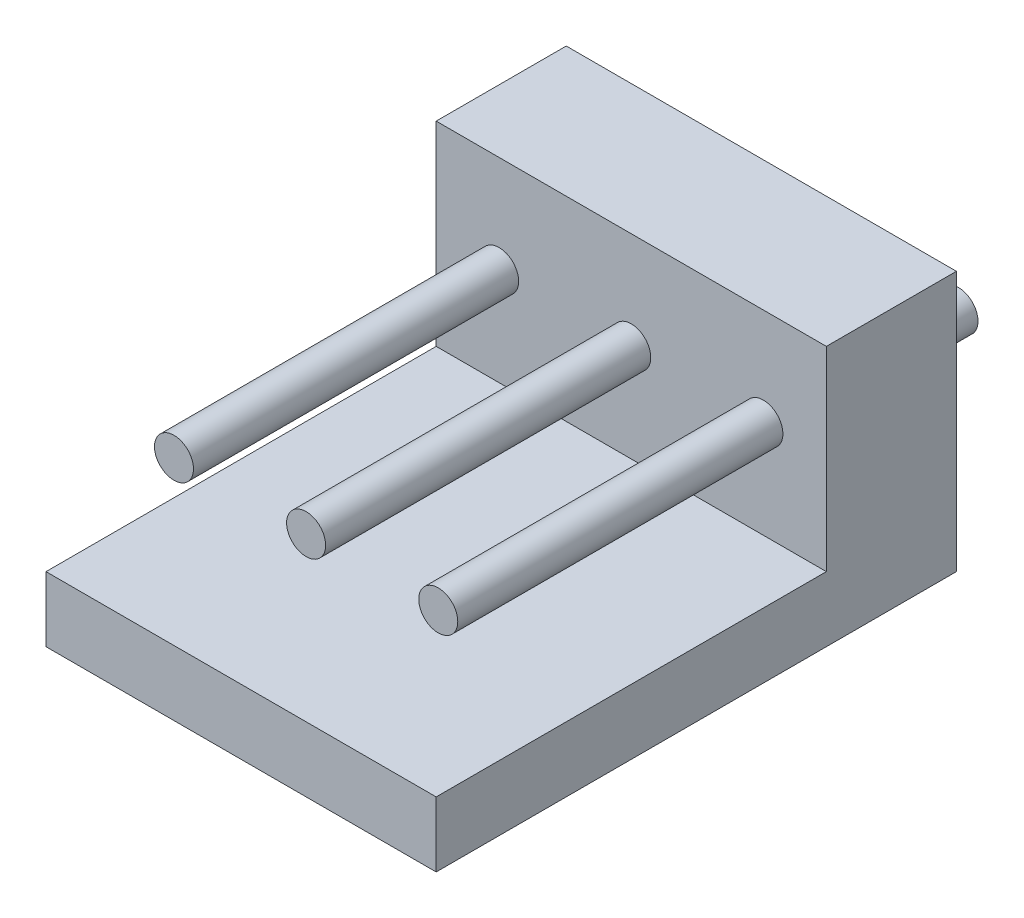
from build123d import *

# Parameters (mm, degrees)
SKETCH_1_W           = 15
SKETCH_1_H           = 10
EXTRUDE_1_DEPTH      = 5
SKETCH_2_W           = 15
SKETCH_2_H           = 2.5
EXTRUDE_2_DEPTH      = 15
EXTRUDE_3_DEPTH      = 12.5
EXTRUDE_3_DEPTH_BACK = 7.5
SKETCH_3_R           = 0.75


with BuildPart() as part:
    # Эскиз1 → Вытянуть1 (new body)
    with BuildSketch(Plane.XY):
        with Locations((7.5, 5)):
            Rectangle(SKETCH_1_W, SKETCH_1_H)
    extrude(amount=EXTRUDE_1_DEPTH)

    # Эскиз2 → Вытянуть2 (add)
    with BuildSketch(Plane.XY.offset(5)):
        with Locations((7.5, 1.25)):
            Rectangle(SKETCH_2_W, SKETCH_2_H)
    extrude(amount=EXTRUDE_2_DEPTH)

    # Эскиз3 → Вытянуть3 (add, two sides: drawn at the far end of the back side and taken through both)
    with BuildSketch(Plane.XY.offset(5).offset(-EXTRUDE_3_DEPTH_BACK)):
        with Locations((12.58, 6.25)):
            Circle(SKETCH_3_R)
        with Locations((2.42, 6.25)):
            Circle(SKETCH_3_R)
        with Locations((7.5, 6.25)):
            Circle(SKETCH_3_R)
    extrude(amount=EXTRUDE_3_DEPTH + EXTRUDE_3_DEPTH_BACK)


solid = part.part
